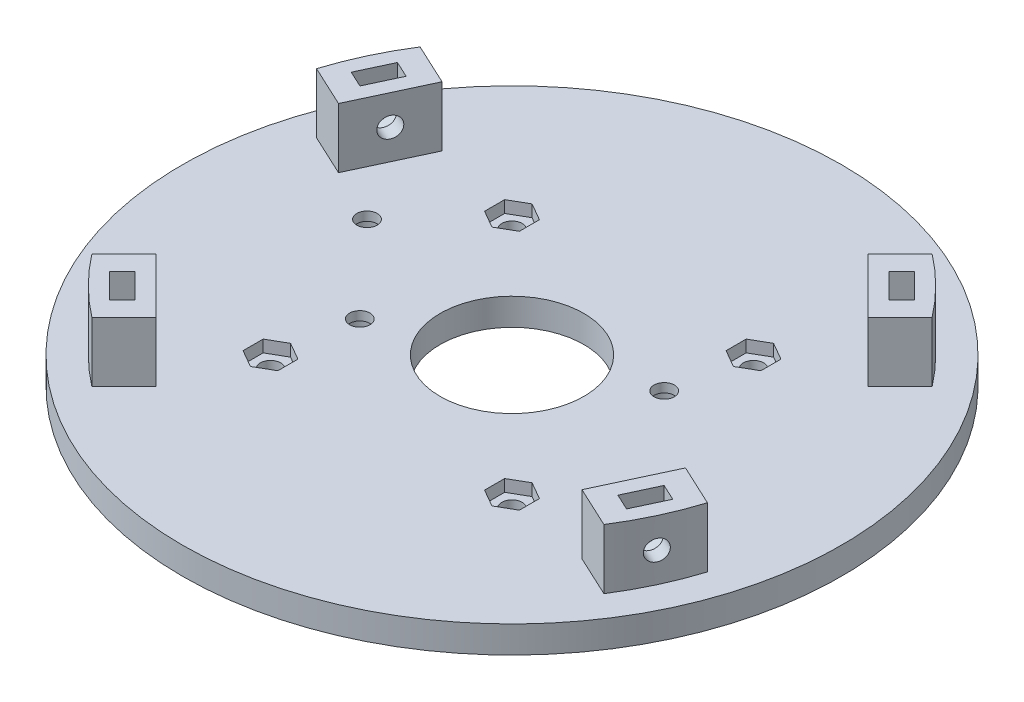
from build123d import *

# Parameters (mm, degrees)
CROQUIS1_W               = 43
CROQUIS1_H               = 4.5
CROQUIS2_R               = 1.7
CORTAR_EXTRUIR1_DEPTH    = 10
CORTAR_EXTRUIR2_DEPTH    = 2
CROQUIS4_R               = 2.95
CORTAR_EXTRUIR3_DEPTH    = 3
SALIENTE_EXTRUIR1_DEPTH  = 10
CROQUIS6_R               = 1.7
CORTAR_EXTRUIR4_DEPTH    = 10
CORTAR_EXTRUIR5_DEPTH    = 1.5
MATRIZC1_COUNT           = 2
MATRIZC1_ANGLE           = 70
MATRIZC2_COUNT           = 2
MATRIZC2_COPY_1_DEPTH    = 10
MATRIZC2_COPY_2_SKETCH_R = 1.7
MATRIZC2_COPY_2_DEPTH    = 10
MATRIZC2_COPY_3_DEPTH    = 1.5


with BuildPart() as part:
    # Croquis1 → Revolución1 (revolve)
    with BuildSketch(Plane.XY, mode=Mode.PRIVATE) as revoluci_n1_sk:
        with Locations((33.5, 2.25)):
            Rectangle(CROQUIS1_W, CROQUIS1_H)
    revolve(revoluci_n1_sk.sketch.rotate(Axis((0, 115.94715176, 0), (0, -1, 0)), 90), axis=Axis((0, 115.94715176, 0), (0, -1, 0)))

    # Croquis2 → Cortar-Extruir1 (cut)
    with BuildSketch(Plane(origin=(0, 4.5, 0), x_dir=(1, 0, 0), z_dir=(0, 1, 0))):
        with Locations(Location((-31.7, 7.5, 0), (0, 0, 270))):
            Circle(CROQUIS2_R)
        with Locations(Location((17.9, 7.5, 0), (0, 0, 270))):
            Circle(CROQUIS2_R)
        with Locations(Location((-17.9, -7.5, 0), (0, 0, 270))):
            Circle(CROQUIS2_R)
        with Locations(Location((31.7, -7.5, 0), (0, 0, 270))):
            Circle(CROQUIS2_R)
        with Locations(Location((20.152543264, 20.152543264, 0), (0, 0, 270))):
            Circle(CROQUIS2_R)
        with Locations(Location((-20.152543264, 20.152543264, 0), (0, 0, 270))):
            Circle(CROQUIS2_R)
        with Locations(Location((-20.152543264, -20.152543264, 0), (0, 0, 270))):
            Circle(CROQUIS2_R)
        with Locations(Location((20.152543264, -20.152543264, 0), (0, 0, 270))):
            Circle(CROQUIS2_R)
    extrude(amount=-CORTAR_EXTRUIR1_DEPTH, mode=Mode.SUBTRACT)

    # Croquis3 → Cortar-Extruir2 (cut)
    with BuildSketch(Plane(origin=(0, 4.5, 0), x_dir=(1, 0, 0), z_dir=(0, 1, 0))):
        Polygon((-20.152543264, 23.502543264), (-23.053728366, 21.827543264), (-23.053728366, 18.477543264), (-20.152543264, 16.802543264), (-17.251358161, 18.477543264), (-17.251358161, 21.827543264), align=None)
        Polygon((20.152543264, 23.502543264), (17.251358161, 21.827543264), (17.251358161, 18.477543264), (20.152543264, 16.802543264), (23.053728366, 18.477543264), (23.053728366, 21.827543264), align=None)
        Polygon((-20.152543264, -16.802543264), (-23.053728366, -18.477543264), (-23.053728366, -21.827543264), (-20.152543264, -23.502543264), (-17.251358161, -21.827543264), (-17.251358161, -18.477543264), align=None)
        Polygon((20.152543264, -16.802543264), (17.251358161, -18.477543264), (17.251358161, -21.827543264), (20.152543264, -23.502543264), (23.053728366, -21.827543264), (23.053728366, -18.477543264), align=None)
    extrude(amount=-CORTAR_EXTRUIR2_DEPTH, mode=Mode.SUBTRACT)

    # Croquis4 → Cortar-Extruir3 (cut)
    with BuildSketch(Plane(origin=(0, 0, 0), x_dir=(1, 0, 0), z_dir=(0, 1, 0))):
        with Locations(Location((-31.7, 7.5, 0), (0, 0, 270))):
            Circle(CROQUIS4_R)
        with Locations(Location((-17.9, -7.5, 0), (0, 0, 270))):
            Circle(CROQUIS4_R)
        with Locations(Location((17.9, 7.5, 0), (0, 0, 270))):
            Circle(CROQUIS4_R)
        with Locations(Location((31.7, -7.5, 0), (0, 0, 270))):
            Circle(CROQUIS4_R)
    extrude(amount=CORTAR_EXTRUIR3_DEPTH, mode=Mode.SUBTRACT)

    # Croquis5 → Saliente-Extruir1 (add)
    with BuildSketch(Plane(origin=(0, 4.5, 0), x_dir=(1, 0, 0), z_dir=(0, 1, 0))):
        with BuildLine():
            Line((-34.294678888, -25.102290732), (-25.102290732, -34.294678888))
            Line((-25.102290732, -34.294678888), (-30.459119357, -39.651507512))
            ThreePointArc((-30.459119357, -39.651507512), (-35.355339059, -35.355339059), (-39.651507512, -30.459119357))
            Line((-39.651507512, -30.459119357), (-34.294678888, -25.102290732))
        make_face()
    saliente_extruir1 = extrude(amount=SALIENTE_EXTRUIR1_DEPTH)

    # Croquis6 → Cortar-Extruir4 (cut)
    with BuildSketch(Plane(origin=(-29.69848481, 0, 29.69848481), x_dir=(-0.7071067811865479, 0, -0.7071067811865472), z_dir=(0.7071067811865472, 0, -0.7071067811865479))):
        with Locations((0, 9.5)):
            Circle(CROQUIS6_R)
    cortar_extruir4 = extrude(amount=-CORTAR_EXTRUIR4_DEPTH, mode=Mode.SUBTRACT)

    # Croquis7 → Cortar-Extruir5 (cut, symmetric)
    with BuildSketch(Plane(origin=(-32.526911935, 0, 32.526911935), x_dir=(0.7071067811865478, 0, 0.7071067811865472), z_dir=(-0.7071067811865472, 0, 0.7071067811865478))):
        Polygon((-2.901185103, 11.175), (-2.901185103, 17.825), (2.901185103, 17.825), (2.901185103, 11.175), (2.901185103, 7.825), (0, 6.15), (-2.901185103, 7.825), align=None)
    cortar_extruir5 = extrude(amount=CORTAR_EXTRUIR5_DEPTH, both=True, mode=Mode.SUBTRACT)

    # MatrizC1: Saliente-Extruir1, Cortar-Extruir4, Cortar-Extruir5 ×2 about axis
    matrizc1_axis = Axis((0, 0, 0), (0, -1, 0))
    add([saliente_extruir1.rotate(matrizc1_axis, i * MATRIZC1_ANGLE / (MATRIZC1_COUNT - 1)) for i in range(1, MATRIZC1_COUNT)])
    add([cortar_extruir4.rotate(matrizc1_axis, i * MATRIZC1_ANGLE / (MATRIZC1_COUNT - 1)) for i in range(1, MATRIZC1_COUNT)], mode=Mode.SUBTRACT)
    add([cortar_extruir5.rotate(matrizc1_axis, i * MATRIZC1_ANGLE / (MATRIZC1_COUNT - 1)) for i in range(1, MATRIZC1_COUNT)], mode=Mode.SUBTRACT)

    # MatrizC2: Saliente-Extruir1, Cortar-Extruir4, Cortar-Extruir5 ×2 about axis
    matrizc2_axis = Axis((0, 0, 0), (0, 1, 0))
    add([saliente_extruir1.rotate(matrizc2_axis, i * 360 / MATRIZC2_COUNT) for i in range(1, MATRIZC2_COUNT)])
    add([cortar_extruir4.rotate(matrizc2_axis, i * 360 / MATRIZC2_COUNT) for i in range(1, MATRIZC2_COUNT)], mode=Mode.SUBTRACT)
    add([cortar_extruir5.rotate(matrizc2_axis, i * 360 / MATRIZC2_COUNT) for i in range(1, MATRIZC2_COUNT)], mode=Mode.SUBTRACT)

    # MatrizC2 copy 1 sketch → MatrizC2 copy 1 (add)
    with BuildSketch(Plane(origin=(0, 4.5, 0), x_dir=(-0.342020143325666, 0, -0.9396926207859093), z_dir=(0, 1, 0))):
        with BuildLine():
            Line((-34.294678888, -25.102290732), (-25.102290732, -34.294678888))
            Line((-25.102290732, -34.294678888), (-30.459119357, -39.651507512))
            ThreePointArc((-30.459119357, -39.651507512), (-35.355339059, -35.355339059), (-39.651507512, -30.459119357))
            Line((-39.651507512, -30.459119357), (-34.294678888, -25.102290732))
        make_face()
    extrude(amount=MATRIZC2_COPY_1_DEPTH)

    # MatrizC2 copy 2 sketch → MatrizC2 copy 2 (cut)
    with BuildSketch(Plane(origin=(38.064927056, 0, 17.749966993), x_dir=(-0.42261826174070166, 0, 0.9063077870366489), z_dir=(-0.9063077870366489, 0, -0.42261826174070166))):
        with Locations((0, 9.5)):
            Circle(MATRIZC2_COPY_2_SKETCH_R)
    extrude(amount=-MATRIZC2_COPY_2_DEPTH, mode=Mode.SUBTRACT)

    # MatrizC2 copy 3 sketch → MatrizC2 copy 3 (cut, symmetric)
    with BuildSketch(Plane(origin=(41.690158204, 0, 19.44044004), x_dir=(0.4226182617407017, 0, -0.9063077870366489), z_dir=(0.9063077870366489, 0, 0.4226182617407017))):
        Polygon((-2.901185103, 11.175), (-2.901185103, 17.825), (2.901185103, 17.825), (2.901185103, 11.175), (2.901185103, 7.825), (0, 6.15), (-2.901185103, 7.825), align=None)
    extrude(amount=MATRIZC2_COPY_3_DEPTH, both=True, mode=Mode.SUBTRACT)


solid = part.part
